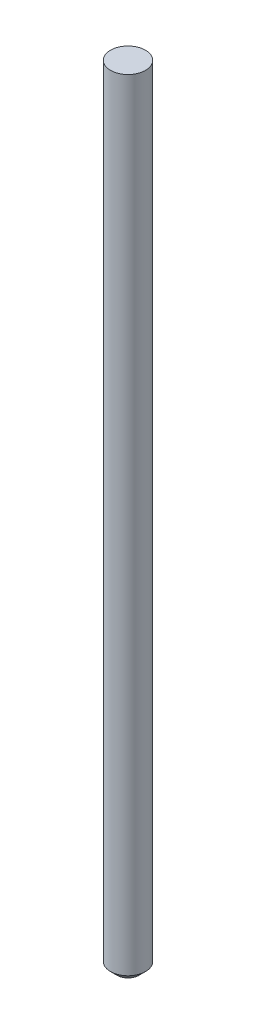
from build123d import *

# Parameters (mm, degrees)
SKETCH1_R           = 4
BOSS_EXTRUDE1_DEPTH = 180
CHAMFER1_SIZE       = 1.5


with BuildPart() as part:
    # Sketch1 → Boss-Extrude1 (new body)
    with BuildSketch(Plane(origin=(0, 0, 0), x_dir=(1, 0, 0), z_dir=(0, 1, 0))):
        with Locations(Location((0, 0, 0), (0, 0, 90))):
            Circle(SKETCH1_R)
    extrude(amount=BOSS_EXTRUDE1_DEPTH)

    # Chamfer1
    chamfer1_edges = [part.edges().sort_by_distance(p)[0] for p in [
        (0, 0, 4),
    ]]
    chamfer(chamfer1_edges, length=CHAMFER1_SIZE)


solid = part.part
